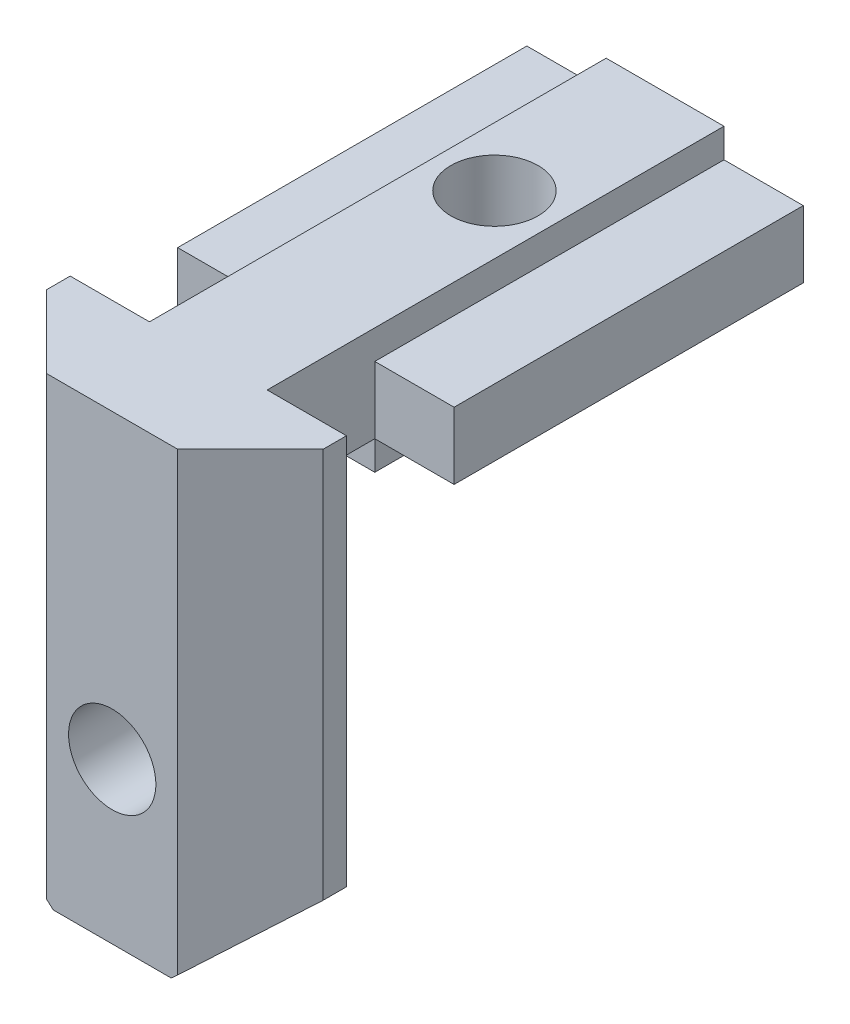
from build123d import *

# Parameters (mm, degrees)
SKETCH_2_W          = 19
SKETCH_2_H          = 31.7
EXTRUDE_1_DEPTH     = 6.6
SKETCH_3_W          = 19
SKETCH_3_H          = 38
EXTRUDE_2_DEPTH     = 6.6
SKETCH_4_W          = 8.1
SKETCH_4_H          = 25.10428036
EXTRUDE_3_DEPTH     = 2
SKETCH_5_W          = 8.1
SKETCH_5_H          = 24
EXTRUDE_4_DEPTH     = 2
SKETCH_6_W          = 5.45
SKETCH_6_H          = 7.386023797
SKETCH_6_H_2        = 7.397863342
CUT_EXTRUDE_1_DEPTH = 42.306415967
CHAMFER_1_SIZE      = 5
SKETCH_7_R          = 3
CUT_EXTRUDE_2_DEPTH = 35.725098992
SKETCH_8_R          = 3
CUT_EXTRUDE_3_DEPTH = 41.122562231
SKETCH_9_W          = 5.45
SKETCH_9_H          = 2
CUT_EXTRUDE_4_DEPTH = 25
CUT_EXTRUDE_5_DEPTH = 35.725098992


with BuildPart() as part:
    # 草图2 → 凸台-拉伸1 (new body)
    with BuildSketch(Plane.XY):
        Rectangle(SKETCH_2_W, SKETCH_2_H)
    extrude(amount=EXTRUDE_1_DEPTH)

    # 草图3 → 凸台-拉伸2 (add)
    with BuildSketch(Plane(origin=(0, 15.85, 0), x_dir=(1, 0, 0), z_dir=(0, 1, 0))):
        with Locations((0, 12.4)):
            Rectangle(SKETCH_3_W, SKETCH_3_H)
    extrude(amount=-EXTRUDE_2_DEPTH)

    # 草图4 → 凸台-拉伸3 (add)
    with BuildSketch(Plane(origin=(0, 0, 0), x_dir=(-1, 0, 0), z_dir=(0, 0, -1))):
        with Locations((0, -3.29785982)):
            Rectangle(SKETCH_4_W, SKETCH_4_H)
    extrude(amount=EXTRUDE_3_DEPTH)

    # 草图5 → 凸台-拉伸4 (add)
    with BuildSketch(Plane.XZ.offset(-9.25)):
        with Locations((0, -19.4)):
            Rectangle(SKETCH_5_W, SKETCH_5_H)
    extrude(amount=EXTRUDE_4_DEPTH)

    # 草图6 → 切除-拉伸1 (cut, through all)
    with BuildSketch(Plane.XZ.offset(-9.25)):
        with Locations((-6.775, -3.706988102)):
            Rectangle(SKETCH_6_W, SKETCH_6_H)
        with Locations((6.775, -3.701068329)):
            Rectangle(SKETCH_6_W, SKETCH_6_H_2)
    extrude(amount=-CUT_EXTRUDE_1_DEPTH, mode=Mode.SUBTRACT)

    # 倒角1
    chamfer_1_edges = [part.edges().sort_by_distance(p)[0] for p in [
        (-9.5, 0, 6.6),
        (9.5, 0, 6.6),
    ]]
    chamfer(chamfer_1_edges, length=CHAMFER_1_SIZE)

    # 草图7 → 切除-拉伸2 (cut, through all)
    with BuildSketch(Plane(origin=(0, 0, -2), x_dir=(-1, 0, 0), z_dir=(0, 0, -1))):
        with Locations((0, -4.859710354)):
            Circle(SKETCH_7_R)
    extrude(amount=-CUT_EXTRUDE_2_DEPTH, mode=Mode.SUBTRACT)

    # 草图8 → 切除-拉伸3 (cut, through all)
    with BuildSketch(Plane.XZ.offset(-7.25)):
        with Locations(Location((0, -19.674028048, 0), (0, 0, 270))):
            Circle(SKETCH_8_R)
    extrude(amount=-CUT_EXTRUDE_3_DEPTH, mode=Mode.SUBTRACT)

    # 草图9 → 切除-拉伸4 (cut)
    with BuildSketch(Plane(origin=(0, 0, -31.4), x_dir=(-1, 0, 0), z_dir=(0, 0, -1))):
        with Locations((-6.775, 14.85)):
            Rectangle(SKETCH_9_W, SKETCH_9_H)
        with Locations((6.775, 14.85)):
            Rectangle(SKETCH_9_W, SKETCH_9_H)
    extrude(amount=-CUT_EXTRUDE_4_DEPTH, mode=Mode.SUBTRACT)

    # 草图10 → 切除-拉伸5 (cut, through all)
    with BuildSketch(Plane(origin=(0, 0, -2), x_dir=(-1, 0, 0), z_dir=(0, 0, -1))):
        Polygon((-4.05, -15.85), (-9.5, -10.999261641), (-9.5, -15.85), align=None)
    cut_extrude_5 = extrude(amount=-CUT_EXTRUDE_5_DEPTH, mode=Mode.SUBTRACT)

    # 镜向1: 切除-拉伸5 across plane
    add(cut_extrude_5.mirror(Plane(origin=(0, 0, 0), x_dir=(0, 0, 1), z_dir=(1, 0, 0))), mode=Mode.SUBTRACT)


solid = part.part
